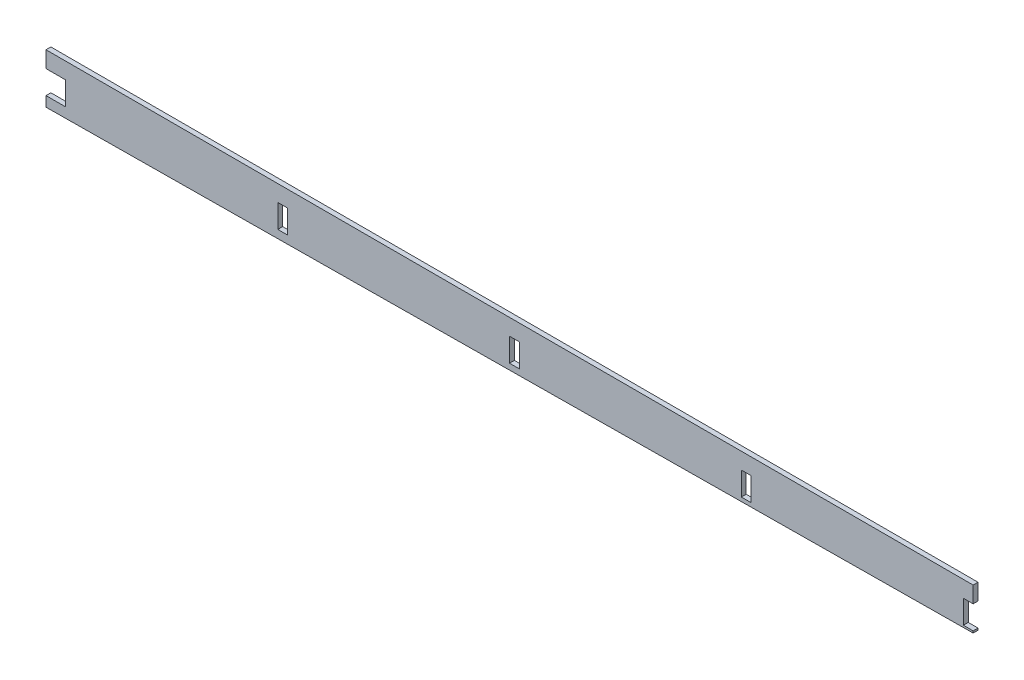
from build123d import *

# Parameters (mm, degrees)
SKETCH1_W           = 3.175
SKETCH1_H           = 7.62
BOSS_EXTRUDE1_DEPTH = 1.5875


with BuildPart() as part:
    # Sketch1 → Boss-Extrude1 (new body)
    with BuildSketch(Plane.XY):
        Polygon((232.626798958, 25.527772685), (-69.633201042, 22.867122461), (-69.633201042, 26.152979633), (-63.283201042, 26.152979633), (-63.283201042, 33.772979633), (-69.633201042, 33.772979633), (-69.633201042, 39.09426549), (232.626798958, 39.09426549), (232.626798958, 33.772979633), (229.451798958, 33.772979633), (229.451798958, 26.152979633), (232.626798958, 26.152979633), align=None)
        with Locations((158.649298958, 29.962979633)):
            Rectangle(SKETCH1_W, SKETCH1_H, mode=Mode.SUBTRACT)
        with Locations((83.084298958, 29.962979633)):
            Rectangle(SKETCH1_W, SKETCH1_H, mode=Mode.SUBTRACT)
        with Locations((7.519298958, 29.962979633)):
            Rectangle(SKETCH1_W, SKETCH1_H, mode=Mode.SUBTRACT)
    extrude(amount=BOSS_EXTRUDE1_DEPTH)


solid = part.part
